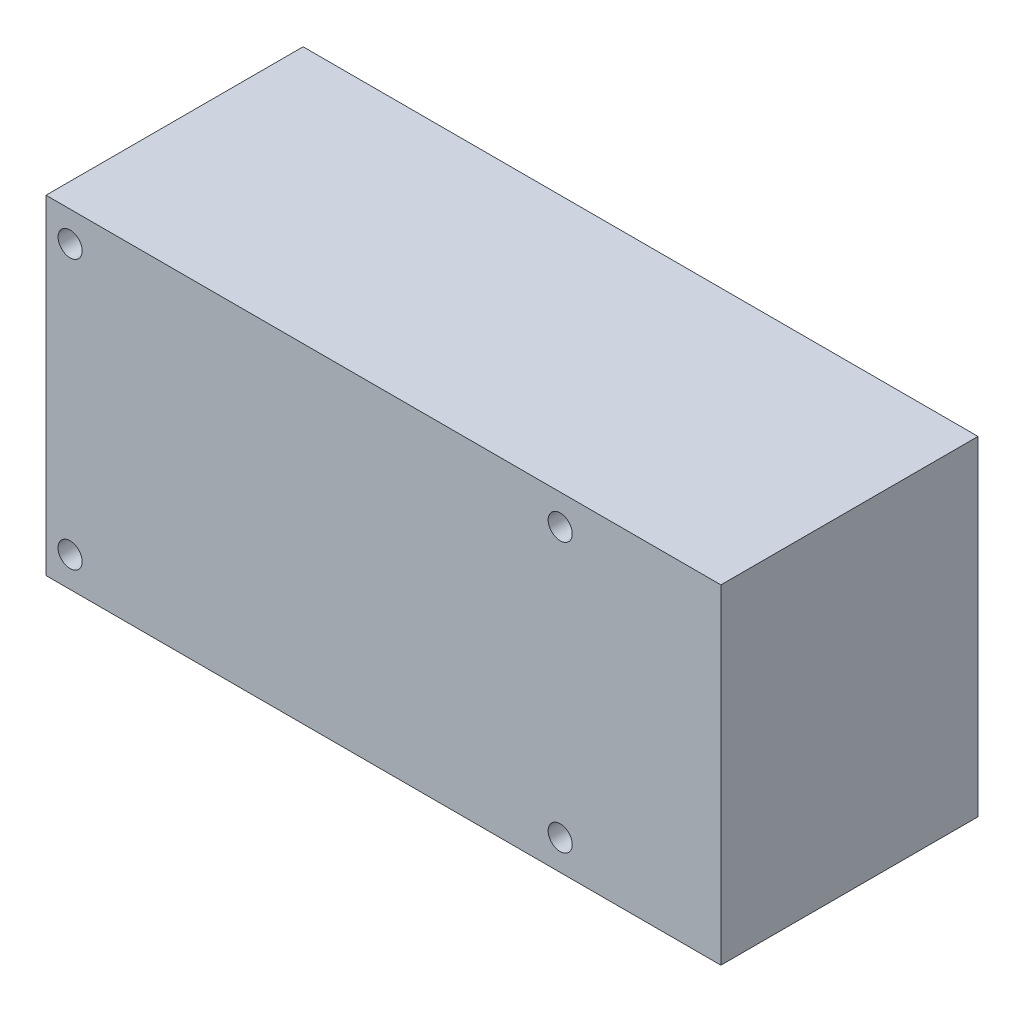
from build123d import *

# Parameters (mm, degrees)
SKETCH_1_W          = 84
SKETCH_1_H          = 41
EXTRUDE_1_DEPTH     = 32
SKETCH_2_R          = 1.5
CUT_EXTRUDE_1_DEPTH = 32


with BuildPart() as part:
    # 草图1 → 凸台-拉伸1 (new body)
    with BuildSketch(Plane.XY):
        with Locations((42, 20.5)):
            Rectangle(SKETCH_1_W, SKETCH_1_H)
    extrude(amount=EXTRUDE_1_DEPTH)

    # 草图2 → 切除-拉伸1 (cut)
    with BuildSketch(Plane.XY.offset(32)):
        with Locations((3, 3.75)):
            Circle(SKETCH_2_R)
        with Locations((64, 3.75)):
            Circle(SKETCH_2_R)
        with Locations(Location((64, 37.25, 0), (0, 0, 180))):
            Circle(SKETCH_2_R)
        with Locations(Location((3, 37.25, 0), (0, 0, 180))):
            Circle(SKETCH_2_R)
    extrude(amount=-CUT_EXTRUDE_1_DEPTH, mode=Mode.SUBTRACT)


solid = part.part
